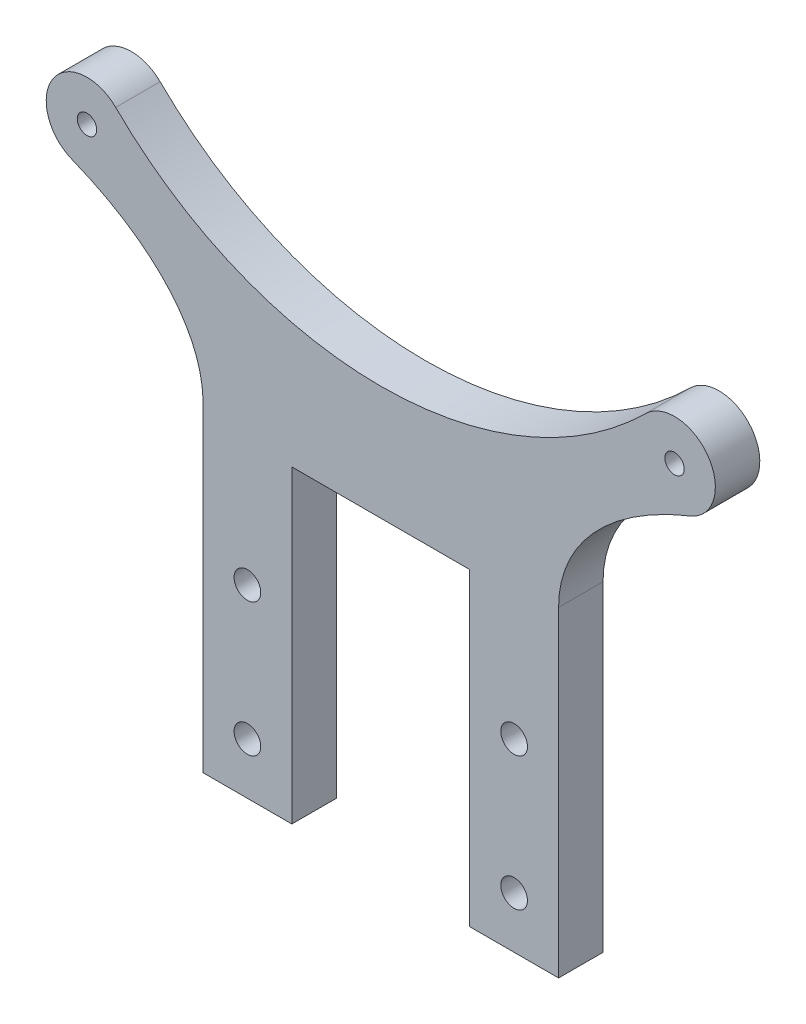
from build123d import *

# Parameters (mm, degrees)
SKETCH1_R           = 1.3890625
SKETCH1_R_2         = 1.905
BOSS_EXTRUDE1_DEPTH = 6.35


with BuildPart() as part:
    # Sketch1 → Boss-Extrude1 (new body)
    with BuildSketch(Plane.XY):
        with BuildLine():
            Line((-12.7, 0), (12.7, 0))
            Line((12.7, 0), (12.7, -44.17993629))
            Line((12.7, -44.17993629), (25.4, -44.17993629))
            Line((25.4, -44.17993629), (25.4, 1.670328163))
            add(Edge.make_bspline(
                [(44.125949546, 22.331244449), (25.4, 14.854059832), (25.4, 1.670328163)],
                knots=[5.315433213, 5.315433213, 5.315433213, 6.283185307, 6.283185307, 6.283185307], degree=2, weights=[1, 0.885198386, 1]))
            ThreePointArc((44.125949546, 22.331244449), (46.840636379, 30.938926797), (37.865222263, 31.889537886))
            ThreePointArc((37.865222263, 31.889537886), (0, 16.327682908), (-37.865222263, 31.889537886))
            ThreePointArc((-37.865222263, 31.889537886), (-46.840636379, 30.938926797), (-44.125949546, 22.331244449))
            add(Edge.make_bspline(
                [(-25.4, 1.670328163), (-25.4, 14.854059832), (-44.125949546, 22.331244449)],
                knots=[0, 0, 0, 0.967752094, 0.967752094, 0.967752094], degree=2, weights=[1, 0.885198386, 1]))
            Line((-25.4, 1.670328163), (-25.4, -44.17993629))
            Line((-25.4, -44.17993629), (-12.7, -44.17993629))
            Line((-12.7, -44.17993629), (-12.7, 0))
        make_face()
        with Locations(Location((41.964300524, 27.744903812, 0), (0, 0, 180))):
            Circle(SKETCH1_R, mode=Mode.SUBTRACT)
        with Locations((-41.964300524, 27.744903812)):
            Circle(SKETCH1_R, mode=Mode.SUBTRACT)
        with Locations((-19.05, -17.78)):
            Circle(SKETCH1_R_2, mode=Mode.SUBTRACT)
        with Locations((-19.05, -36.83)):
            Circle(SKETCH1_R_2, mode=Mode.SUBTRACT)
        with Locations(Location((19.05, -36.83, 0), (0, 0, 180))):
            Circle(SKETCH1_R_2, mode=Mode.SUBTRACT)
        with Locations(Location((19.05, -17.78, 0), (0, 0, 180))):
            Circle(SKETCH1_R_2, mode=Mode.SUBTRACT)
    extrude(amount=BOSS_EXTRUDE1_DEPTH)


solid = part.part
